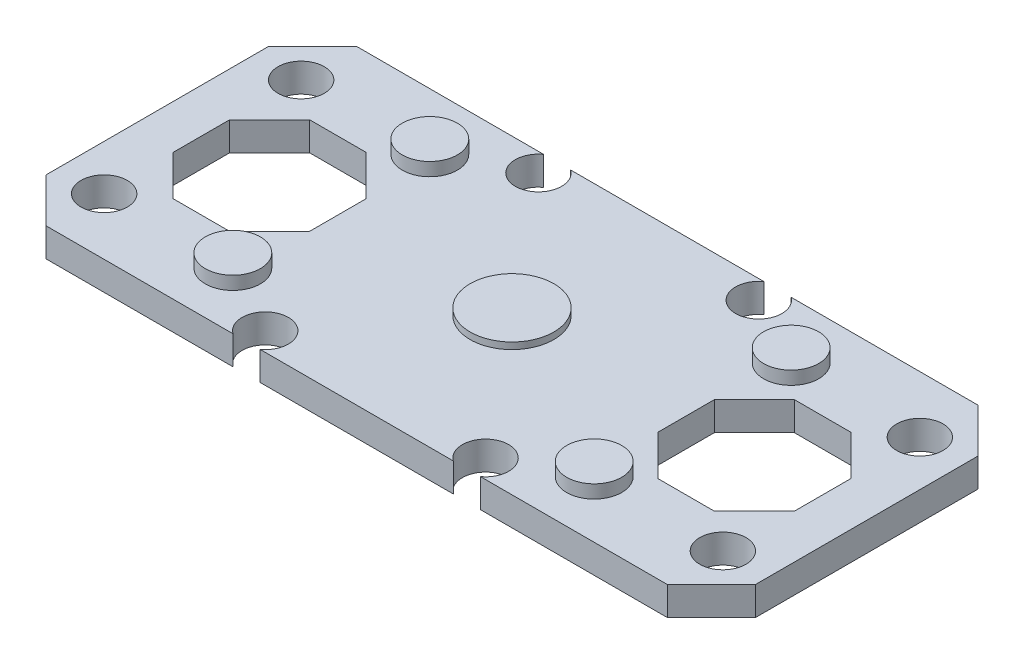
from build123d import *

# Parameters (mm, degrees)
SKETCH1_R           = 1.3335
SKETCH1_R_2         = 1.5875
BOSS_EXTRUDE1_DEPTH = 1.651
CHAMFER1_SIZE       = 2.54
SKETCH1_2_R         = 1.5875
BOSS_EXTRUDE2_DEPTH = 2.413
SKETCH1_3_R         = 1.5875
CUT_EXTRUDE1_DEPTH  = 0.889
CUT_EXTRUDE3_DEPTH  = 23.382376376
SKETCH4_R           = 2.413
BOSS_EXTRUDE3_DEPTH = 0.381
CUT_EXTRUDE4_START  = -1.651
SKETCH4_2_R         = 2.413
CUT_EXTRUDE4_DEPTH  = 0.635


with BuildPart() as part:
    # Sketch1 → Boss-Extrude1 (new body)
    with BuildSketch(Plane(origin=(0, 0, 0), x_dir=(1, 0, 0), z_dir=(0, 1, 0))):
        with BuildLine():
            Line((-5.567119422, 8.9535), (5.567119422, 8.9535))
            ThreePointArc((5.567119422, 8.9535), (6.35, 6.5405), (7.132880578, 8.9535))
            Line((7.132880578, 8.9535), (20.447, 8.9535))
            Line((20.447, 8.9535), (20.447, -8.9535))
            Line((20.447, -8.9535), (7.132880578, -8.9535))
            ThreePointArc((7.132880578, -8.9535), (6.35, -6.5405), (5.567119422, -8.9535))
            Line((5.567119422, -8.9535), (-5.567119422, -8.9535))
            ThreePointArc((-5.567119422, -8.9535), (-6.35, -6.5405), (-7.132880578, -8.9535))
            Line((-7.132880578, -8.9535), (-20.447, -8.9535))
            Line((-20.447, -8.9535), (-20.447, 8.9535))
            Line((-20.447, 8.9535), (-7.132880578, 8.9535))
            ThreePointArc((-7.132880578, 8.9535), (-6.35, 6.5405), (-5.567119422, 8.9535))
        make_face()
        with Locations(Location((-17.8308, 5.6769, 0), (0, 0, 90))):
            Circle(SKETCH1_R, mode=Mode.SUBTRACT)
        with Locations(Location((17.8308, 5.6769, 0), (0, 0, 90))):
            Circle(SKETCH1_R, mode=Mode.SUBTRACT)
        with Locations(Location((17.8308, -5.6769, 0), (0, 0, 90))):
            Circle(SKETCH1_R, mode=Mode.SUBTRACT)
        with Locations(Location((-17.8308, -5.6769, 0), (0, 0, 90))):
            Circle(SKETCH1_R, mode=Mode.SUBTRACT)
        with Locations(Location((-10.414, 5.6769, 0), (0, 0, 90))):
            Circle(SKETCH1_R_2, mode=Mode.SUBTRACT)
        with Locations(Location((10.414, 5.6769, 0), (0, 0, 90))):
            Circle(SKETCH1_R_2, mode=Mode.SUBTRACT)
        with Locations(Location((10.414, -5.6769, 0), (0, 0, 90))):
            Circle(SKETCH1_R_2, mode=Mode.SUBTRACT)
        with Locations(Location((-10.414, -5.6769, 0), (0, 0, 90))):
            Circle(SKETCH1_R_2, mode=Mode.SUBTRACT)
    extrude(amount=BOSS_EXTRUDE1_DEPTH)

    # Chamfer1
    chamfer1_edges = [part.edges().sort_by_distance(p)[0] for p in [
        (20.447, 0.8255, -8.9535),
        (20.447, 0.8255, 8.9535),
        (-20.447, 0.8255, 8.9535),
        (-20.447, 0.8255, -8.9535),
    ]]
    chamfer(chamfer1_edges, length=CHAMFER1_SIZE)

    # Sketch1<2> → Boss-Extrude2 (add)
    with BuildSketch(Plane(origin=(0, 0, 0), x_dir=(1, 0, 0), z_dir=(0, 1, 0))):
        with Locations(Location((-10.414, 5.6769, 0), (0, 0, 270))):
            Circle(SKETCH1_2_R)
        with Locations(Location((10.414, 5.6769, 0), (0, 0, 270))):
            Circle(SKETCH1_2_R)
        with Locations(Location((10.414, -5.6769, 0), (0, 0, 270))):
            Circle(SKETCH1_2_R)
        with Locations(Location((-10.414, -5.6769, 0), (0, 0, 270))):
            Circle(SKETCH1_2_R)
    extrude(amount=BOSS_EXTRUDE2_DEPTH)

    # Sketch1<3> → Cut-Extrude1 (cut)
    with BuildSketch(Plane(origin=(0, 0, 0), x_dir=(1, 0, 0), z_dir=(0, 1, 0))):
        with Locations(Location((-10.414, 5.6769, 0), (0, 0, 270))):
            Circle(SKETCH1_3_R)
        with Locations(Location((10.414, 5.6769, 0), (0, 0, 270))):
            Circle(SKETCH1_3_R)
        with Locations(Location((10.414, -5.6769, 0), (0, 0, 270))):
            Circle(SKETCH1_3_R)
        with Locations(Location((-10.414, -5.6769, 0), (0, 0, 270))):
            Circle(SKETCH1_3_R)
    extrude(amount=CUT_EXTRUDE1_DEPTH, mode=Mode.SUBTRACT)

    # Sketch3 → Cut-Extrude3 (cut, through all)
    with BuildSketch(Plane(origin=(0, 1.651, 0), x_dir=(1, 0, 0), z_dir=(0, 1, 0))):
        Polygon((-10.033, 1.630758795), (-12.339241205, 3.937), (-15.600758795, 3.937), (-17.907, 1.630758795), (-17.907, -1.630758795), (-15.600758795, -3.937), (-12.339241205, -3.937), (-10.033, -1.630758795), align=None)
        Polygon((17.907, 1.630758795), (15.600758795, 3.937), (12.339241205, 3.937), (10.033, 1.630758795), (10.033, -1.630758795), (12.339241205, -3.937), (15.600758795, -3.937), (17.907, -1.630758795), align=None)
    extrude(amount=-CUT_EXTRUDE3_DEPTH, mode=Mode.SUBTRACT)

    # Sketch4 → Boss-Extrude3 (add)
    with BuildSketch(Plane(origin=(0, 1.651, 0), x_dir=(1, 0, 0), z_dir=(0, 1, 0))):
        with Locations(Location((0, 0, 0), (0, 0, 90))):
            Circle(SKETCH4_R)
    extrude(amount=BOSS_EXTRUDE3_DEPTH)

    # Sketch4<2> → Cut-Extrude4 (cut)
    with BuildSketch(Plane(origin=(0, 1.651, 0), x_dir=(1, 0, 0), z_dir=(0, 1, 0)).offset(CUT_EXTRUDE4_START)):
        with Locations(Location((0, 0, 0), (0, 0, 90))):
            Circle(SKETCH4_2_R)
    extrude(amount=CUT_EXTRUDE4_DEPTH, mode=Mode.SUBTRACT)


solid = part.part
